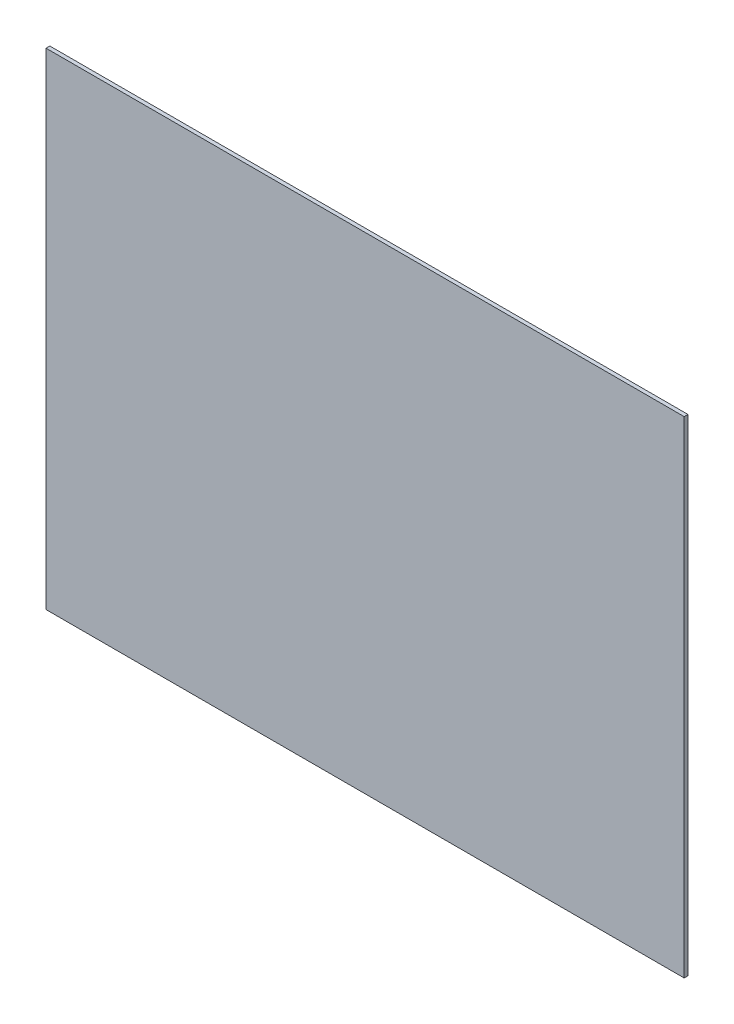
from build123d import *

# Parameters (mm, degrees)
SKETCH1_W           = 800.1
SKETCH1_H           = 609.6
BOSS_EXTRUDE1_DEPTH = 4.7625


with BuildPart() as part:
    # Sketch1 → Boss-Extrude1 (new body)
    with BuildSketch(Plane.XY):
        Rectangle(SKETCH1_W, SKETCH1_H)
    extrude(amount=BOSS_EXTRUDE1_DEPTH)


solid = part.part
